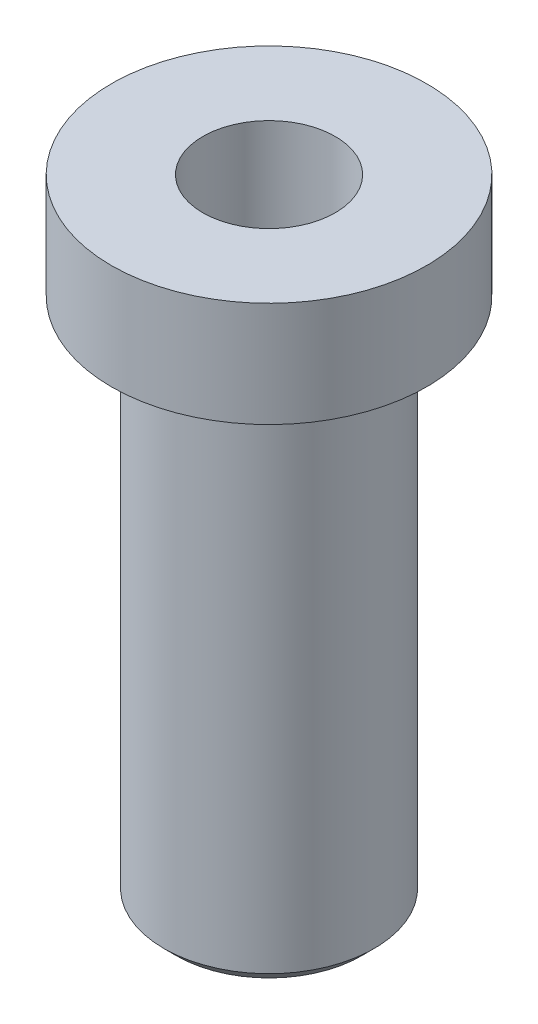
from build123d import *

# Parameters (mm, degrees)
SKETCH2_R           = 12.7
BOSS_EXTRUDE1_DEPTH = 38.1
SKETCH3_R           = 19.05
BOSS_EXTRUDE2_DEPTH = 12.7
HOLE1_D             = 16.002
CHAMFER1_SIZE       = 1.524


with BuildPart() as part:
    # Sketch2 → Boss-Extrude1 (new, symmetric)
    with BuildSketch(Plane(origin=(0, 0, 0), x_dir=(1, 0, 0), z_dir=(0, 1, 0))):
        with Locations(Location((0, 0, 0), (0, 0, 90))):
            Circle(SKETCH2_R)
    extrude(amount=BOSS_EXTRUDE1_DEPTH, both=True)

    # Sketch3 → Boss-Extrude2 (add)
    with BuildSketch(Plane(origin=(0, 38.1, 0), x_dir=(1, 0, 0), z_dir=(0, 1, 0))):
        with Locations(Location((0, 0, 0), (0, 0, 270))):
            Circle(SKETCH3_R)
    extrude(amount=-BOSS_EXTRUDE2_DEPTH)

    # Hole1 (through all)
    with Locations(Plane(origin=(0, 38.1, 0), x_dir=(1, 0, 0), z_dir=(0, 1, 0))):
        with Locations((0, 0)):
            Hole(HOLE1_D / 2)

    # Chamfer1
    chamfer1_edges = [part.edges().sort_by_distance(p)[0] for p in [
        (0, -38.1, 12.7),
    ]]
    chamfer(chamfer1_edges, length=CHAMFER1_SIZE)


solid = part.part
